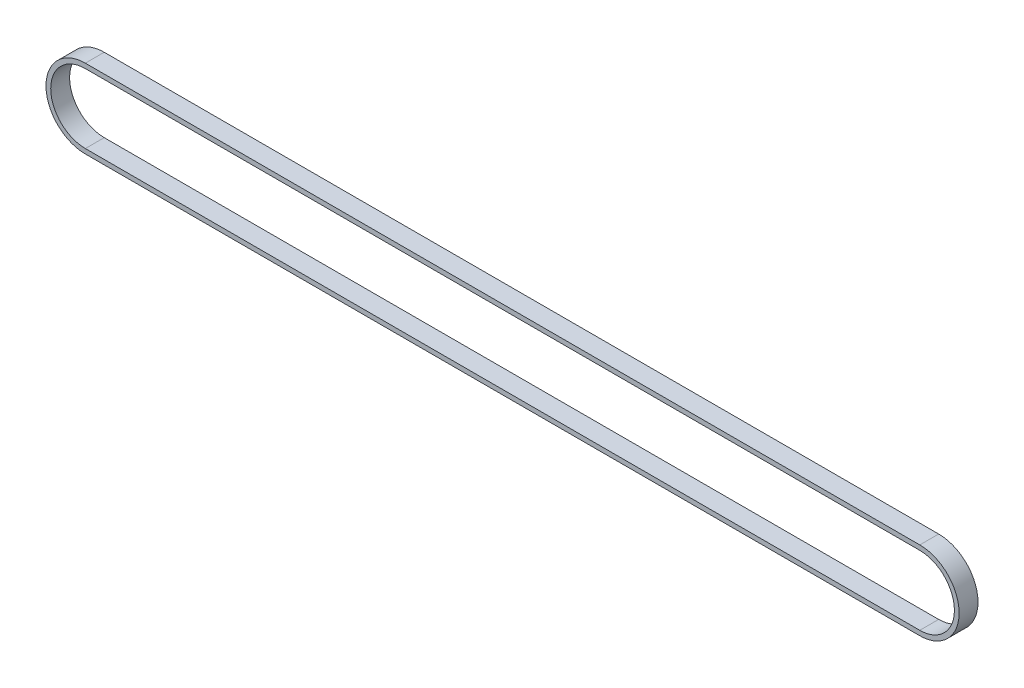
from build123d import *

# Parameters (mm, degrees)
SALIENTE_EXTRUIR1_DEPTH = 6


with BuildPart() as part:
    # Croquis1 → Saliente-Extruir1 (new body)
    with BuildSketch(Plane.XY):
        with BuildLine():
            Line((265.17, 12.5), (0, 12.5))
            ThreePointArc((0, 12.5), (-12.5, 0), (0, -12.5))
            Line((0, -12.5), (265.17, -12.5))
            ThreePointArc((265.17, -12.5), (277.67, 0), (265.17, 12.5))
        make_face()
        with BuildLine():
            Line((0, -11), (265.17, -11))
            ThreePointArc((265.17, -11), (276.17, 0), (265.17, 11))
            Line((265.17, 11), (0, 11))
            ThreePointArc((0, 11), (-11, 0), (0, -11))
        make_face(mode=Mode.SUBTRACT)
    extrude(amount=SALIENTE_EXTRUIR1_DEPTH)


solid = part.part
